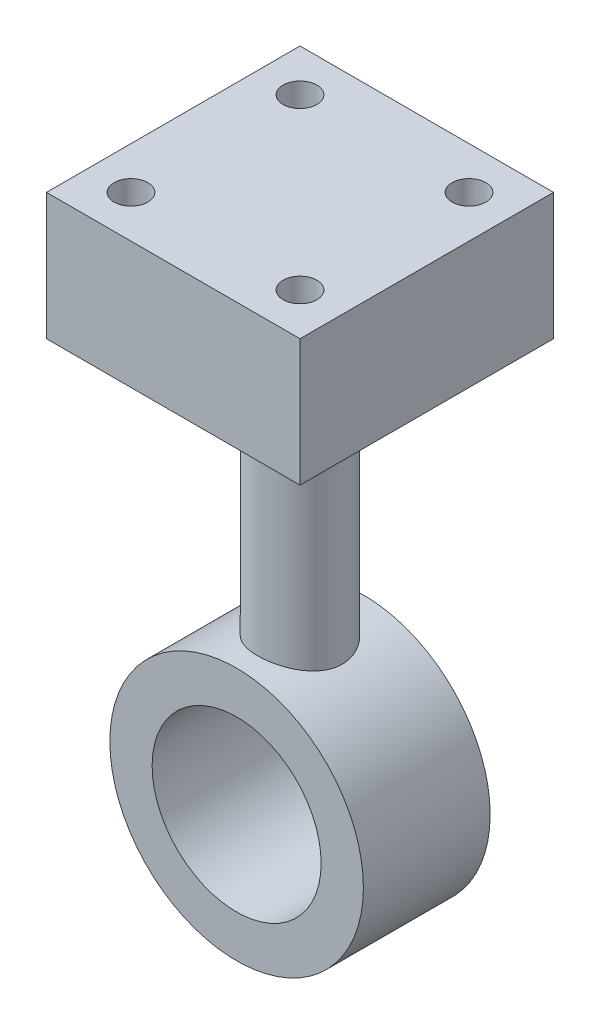
from build123d import *

# Parameters (mm, degrees)
SKETCH_1_R           = 15
SKETCH_1_R_2         = 10
EXTRUDE_1_DEPTH      = 7.5
EXTRUDE_2_REACH      = 64.3
EXTRUDE_2_END_RADIUS = 15
SKETCH_3_R           = 5
SKETCH_4_W           = 30
SKETCH_4_H           = 30
EXTRUDE_3_DEPTH      = 15
SKETCH_5_R           = 2
CUT_EXTRUDE_1_DEPTH  = 78.942286456


with BuildPart() as part:
    # 草图1 → 凸台-拉伸1 (new, symmetric)
    with BuildSketch(Plane.XY):
        Circle(SKETCH_1_R)
        Circle(SKETCH_1_R_2, mode=Mode.SUBTRACT)
    extrude(amount=EXTRUDE_1_DEPTH, both=True)

    # 凸台-拉伸2: up to this cylinder (the profile starts outside it)
    extrude_2_end = Plane(origin=(0, 0, 0), z_dir=(0, 0, -1)) * Cylinder(EXTRUDE_2_END_RADIUS, 159.6, mode=Mode.PRIVATE)
    # 草图3 → 凸台-拉伸2 (add, up to the surface)
    with BuildSketch(Plane(origin=(0, 45, 0), x_dir=(1, 0, 0), z_dir=(0, 1, 0)), mode=Mode.PRIVATE) as extrude_2_sk1:
        with Locations(Location((0, 0, 0), (0, 0, 270))):
            Circle(SKETCH_3_R)
    extrude_2_tool1 = extrude(extrude_2_sk1.sketch, amount=-EXTRUDE_2_REACH, mode=Mode.PRIVATE) - extrude_2_end
    add(extrude_2_tool1.solids().sort_by_distance((0, 45, 0))[0])

    # 草图4 → 凸台-拉伸3 (add)
    with BuildSketch(Plane(origin=(0, 45, 0), x_dir=(1, 0, 0), z_dir=(0, 1, 0))):
        Rectangle(SKETCH_4_W, SKETCH_4_H)
    extrude(amount=EXTRUDE_3_DEPTH)

    # 草图5 → 切除-拉伸1 (cut, through all)
    with BuildSketch(Plane(origin=(0, 60, 0), x_dir=(1, 0, 0), z_dir=(0, 1, 0))):
        with Locations(Location((10, 10, 0), (0, 0, 270))):
            Circle(SKETCH_5_R)
        with Locations(Location((-10, 10, 0), (0, 0, 270))):
            Circle(SKETCH_5_R)
        with Locations(Location((10, -10, 0), (0, 0, 270))):
            Circle(SKETCH_5_R)
        with Locations(Location((-10, -10, 0), (0, 0, 270))):
            Circle(SKETCH_5_R)
    extrude(amount=-CUT_EXTRUDE_1_DEPTH, mode=Mode.SUBTRACT)


solid = part.part
